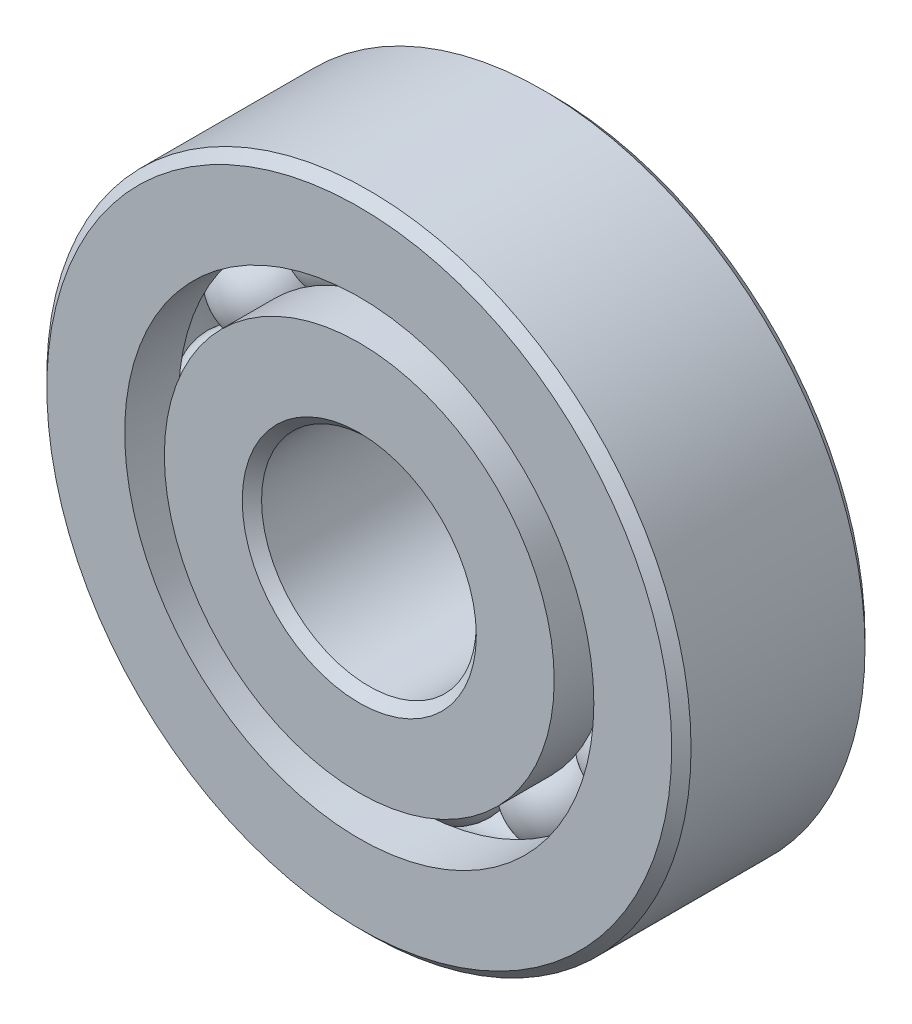
from build123d import *

# Parameters (mm, degrees)
CIRPATTERN1_COUNT = 12


with BuildPart() as part:
    # Sketch1 → Revolve1 (revolve)
    with BuildSketch(Plane(origin=(0, 0, 0), x_dir=(0, 0, -1), z_dir=(1, 0, 0))):
        with BuildLine():
            Line((4.05, 15), (-4.05, 15))
            Line((-4.05, 15), (-4.5, 14.55))
            Line((-4.5, 14.55), (-4.5, 10.923076923))
            Line((-4.5, 10.923076923), (-2, 10.923076923))
            ThreePointArc((-2, 10.923076923), (0, 12.202741702), (2, 10.923076923))
            Line((2, 10.923076923), (4.5, 10.923076923))
            Line((4.5, 10.923076923), (4.5, 14.55))
            Line((4.5, 14.55), (4.05, 15))
        make_face()
    revolve(axis=Axis((0, 0, 4.5), (0, 0, -1)))


with BuildPart() as body_2:
    # Sketch3 → Revolve3 (revolve)
    with BuildSketch(Plane(origin=(0, 0, 0), x_dir=(0, 0, -1), z_dir=(1, 0, 0))):
        with BuildLine():
            Line((-4.5, 9.076923077), (-2, 9.076923077))
            ThreePointArc((-2, 9.076923077), (0, 7.797258298), (2, 9.076923077))
            Line((2, 9.076923077), (4.5, 9.076923077))
            Line((4.5, 9.076923077), (4.5, 5.45))
            Line((4.5, 5.45), (4.05, 5))
            Line((4.05, 5), (-4.05, 5))
            Line((-4.05, 5), (-4.5, 5.45))
            Line((-4.5, 5.45), (-4.5, 9.076923077))
        make_face()
    revolve(axis=Axis((0, 0, 4.5), (0, 0, -1)))


with BuildPart() as body_3:
    # Sketch4 → Revolve4 (revolve)
    with BuildSketch(Plane(origin=(0, 0, 0), x_dir=(0, 0, -1), z_dir=(1, 0, 0))):
        with BuildLine():
            Line((-2.202741702, 10), (2.202741702, 10))
            ThreePointArc((2.202741702, 10), (0, 12.202741702), (-2.202741702, 10))
        make_face()
    revolve(axis=Axis((0, 10, 2.202741702), (0, 0, -1)))


with BuildPart() as cirpattern1_1:
    # CirPattern1: pattern copy
    add(body_3.part.rotate(Axis((0, 0, -4.5), (0, 0, 1)), 1 * 360 / CIRPATTERN1_COUNT))


with BuildPart() as cirpattern1_2:
    # CirPattern1: pattern copy
    add(body_3.part.rotate(Axis((0, 0, -4.5), (0, 0, 1)), 2 * 360 / CIRPATTERN1_COUNT))


with BuildPart() as cirpattern1_3:
    # CirPattern1: pattern copy
    add(body_3.part.rotate(Axis((0, 0, -4.5), (0, 0, 1)), 3 * 360 / CIRPATTERN1_COUNT))


with BuildPart() as cirpattern1_4:
    # CirPattern1: pattern copy
    add(body_3.part.rotate(Axis((0, 0, -4.5), (0, 0, 1)), 4 * 360 / CIRPATTERN1_COUNT))


with BuildPart() as cirpattern1_5:
    # CirPattern1: pattern copy
    add(body_3.part.rotate(Axis((0, 0, -4.5), (0, 0, 1)), 5 * 360 / CIRPATTERN1_COUNT))


with BuildPart() as cirpattern1_6:
    # CirPattern1: pattern copy
    add(body_3.part.rotate(Axis((0, 0, -4.5), (0, 0, 1)), 6 * 360 / CIRPATTERN1_COUNT))


with BuildPart() as cirpattern1_7:
    # CirPattern1: pattern copy
    add(body_3.part.rotate(Axis((0, 0, -4.5), (0, 0, 1)), 7 * 360 / CIRPATTERN1_COUNT))


with BuildPart() as cirpattern1_8:
    # CirPattern1: pattern copy
    add(body_3.part.rotate(Axis((0, 0, -4.5), (0, 0, 1)), 8 * 360 / CIRPATTERN1_COUNT))


with BuildPart() as cirpattern1_9:
    # CirPattern1: pattern copy
    add(body_3.part.rotate(Axis((0, 0, -4.5), (0, 0, 1)), 9 * 360 / CIRPATTERN1_COUNT))


with BuildPart() as cirpattern1_10:
    # CirPattern1: pattern copy
    add(body_3.part.rotate(Axis((0, 0, -4.5), (0, 0, 1)), 10 * 360 / CIRPATTERN1_COUNT))


with BuildPart() as cirpattern1_11:
    # CirPattern1: pattern copy
    add(body_3.part.rotate(Axis((0, 0, -4.5), (0, 0, 1)), 11 * 360 / CIRPATTERN1_COUNT))


solid = Compound([part.part, body_2.part, body_3.part, cirpattern1_1.part, cirpattern1_2.part, cirpattern1_3.part, cirpattern1_4.part, cirpattern1_5.part, cirpattern1_6.part, cirpattern1_7.part, cirpattern1_8.part, cirpattern1_9.part, cirpattern1_10.part, cirpattern1_11.part])
